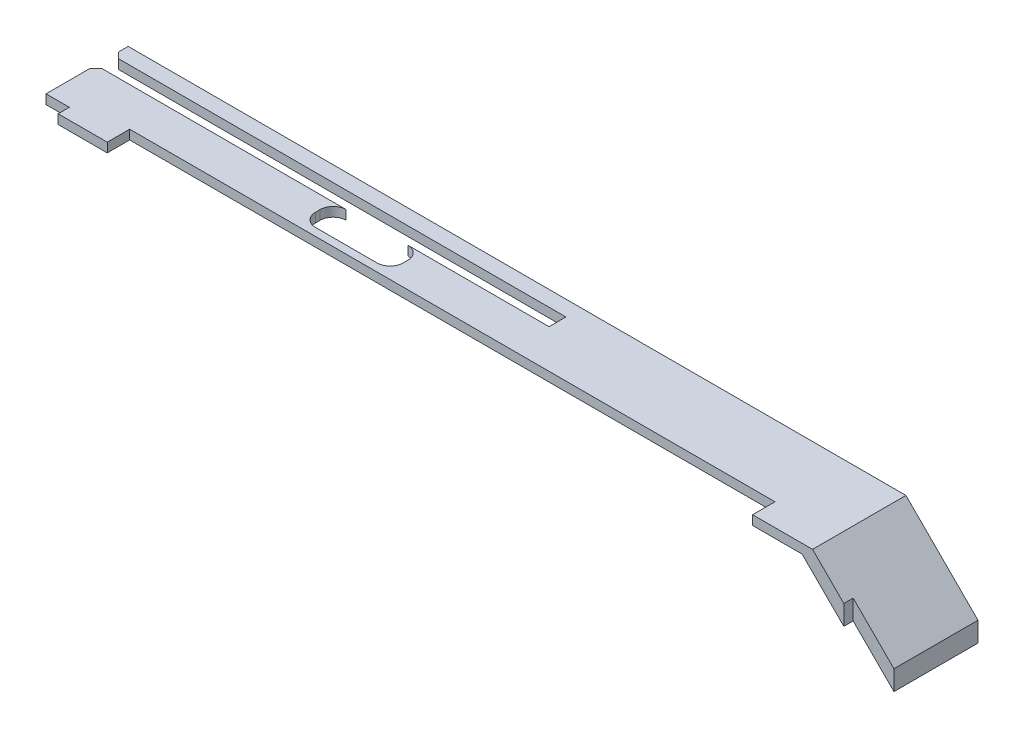
from build123d import *

# Parameters (mm, degrees)
EXTRUDE_1_DEPTH     = 10
CUT_EXTRUDE_1_DEPTH = 78.662529175
SKETCH_3_W          = 48.53
SKETCH_3_H          = 1.8
SKETCH_3_W_2        = 69.1
SKETCH_3_H_2        = 2.4
CUT_EXTRUDE_2_DEPTH = 80.403046846
CUT_EXTRUDE_3_DEPTH = 80.403046846
CHAMFER_1_SIZE      = 0.6


with BuildPart() as part:
    # 草图1 → 凸台-拉伸1 (new body)
    with BuildSketch(Plane(origin=(0, 0, 0), x_dir=(1, 0, 0), z_dir=(0, 1, 0))):
        Polygon((-14.635948, 19.40625), (-14.635948, 10.60625), (-12.135948, 10.60625), (-12.135948, 9.40625), (71.996502, 9.40625), (71.996502, 10.40625), (76.364052, 10.40625), (76.364052, 19.40625), align=None)
    extrude(amount=EXTRUDE_1_DEPTH)

    # 草图2 → 切除-拉伸1 (cut, through all)
    with BuildSketch(Plane.XY.offset(-9.40625)):
        Polygon((-14.635948, 9), (67.526731656, 9), (76.526731656, 0), (-14.635948, 0), align=None)
        Polygon((78.332625034, 0.315426966), (67.430737892, 11.217314108), (78.393598105, 11.217314108), align=None)
    extrude(amount=-CUT_EXTRUDE_1_DEPTH, mode=Mode.SUBTRACT)

    # 草图3 → 切除-拉伸2 (cut, through all)
    with BuildSketch(Plane(origin=(0, 10, 0), x_dir=(1, 0, 0), z_dir=(0, 1, 0))):
        with Locations((9.629052, 16.84625)):
            Rectangle(SKETCH_3_W, SKETCH_3_H)
        with Locations((27.674052, 10.60625)):
            Rectangle(SKETCH_3_W_2, SKETCH_3_H_2)
    extrude(amount=-CUT_EXTRUDE_2_DEPTH, mode=Mode.SUBTRACT)

    # 草图4 → 切除-拉伸3 (cut, through all)
    with BuildSketch(Plane(origin=(0, 10, 0), x_dir=(1, 0, 0), z_dir=(0, 1, 0))):
        with BuildLine():
            Line((12.170037326, 15.94625), (18.770037326, 15.94625))
            ThreePointArc((18.770037326, 15.94625), (19.759986819, 15.536199494), (20.170037326, 14.54625))
            Line((20.170037326, 14.54625), (20.170037326, 14.048022825))
            ThreePointArc((20.170037326, 14.048022825), (19.759986819, 13.058073332), (18.770037326, 12.648022825))
            Line((18.770037326, 12.648022825), (12.170037326, 12.648022825))
            ThreePointArc((12.170037326, 12.648022825), (11.180087832, 13.058073332), (10.770037326, 14.048022825))
            Line((10.770037326, 14.048022825), (10.770037326, 14.54625))
            ThreePointArc((10.770037326, 14.54625), (11.180087832, 15.536199494), (12.170037326, 15.94625))
        make_face()
    extrude(amount=-CUT_EXTRUDE_3_DEPTH, mode=Mode.SUBTRACT)

    # 倒角1
    chamfer_1_edges = [part.edges().sort_by_distance(p)[0] for p in [
        (-14.635948, 9.5, -15.94625),
        (-14.635948, 9.5, -17.74625),
    ]]
    chamfer(chamfer_1_edges, length=CHAMFER_1_SIZE)


solid = part.part
